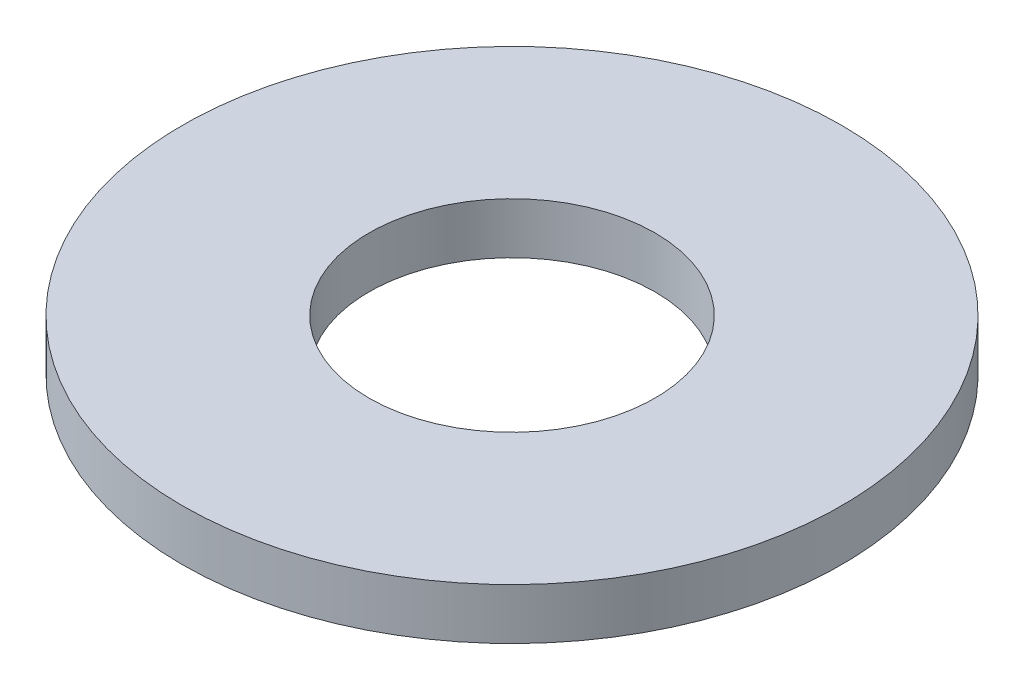
from build123d import *

# Parameters (mm, degrees)
SKETCH1_R           = 6.45
SKETCH1_R_2         = 2.8
BOSS_EXTRUDE1_DEPTH = 1


with BuildPart() as part:
    # Sketch1 → Boss-Extrude1 (new body)
    with BuildSketch(Plane(origin=(0, 0, 0), x_dir=(1, 0, 0), z_dir=(0, 1, 0))):
        with Locations(Location((0, 0, 0), (0, 0, 270))):
            Circle(SKETCH1_R)
        with Locations(Location((0, 0, 0), (0, 0, 270))):
            Circle(SKETCH1_R_2, mode=Mode.SUBTRACT)
    extrude(amount=BOSS_EXTRUDE1_DEPTH)


solid = part.part
